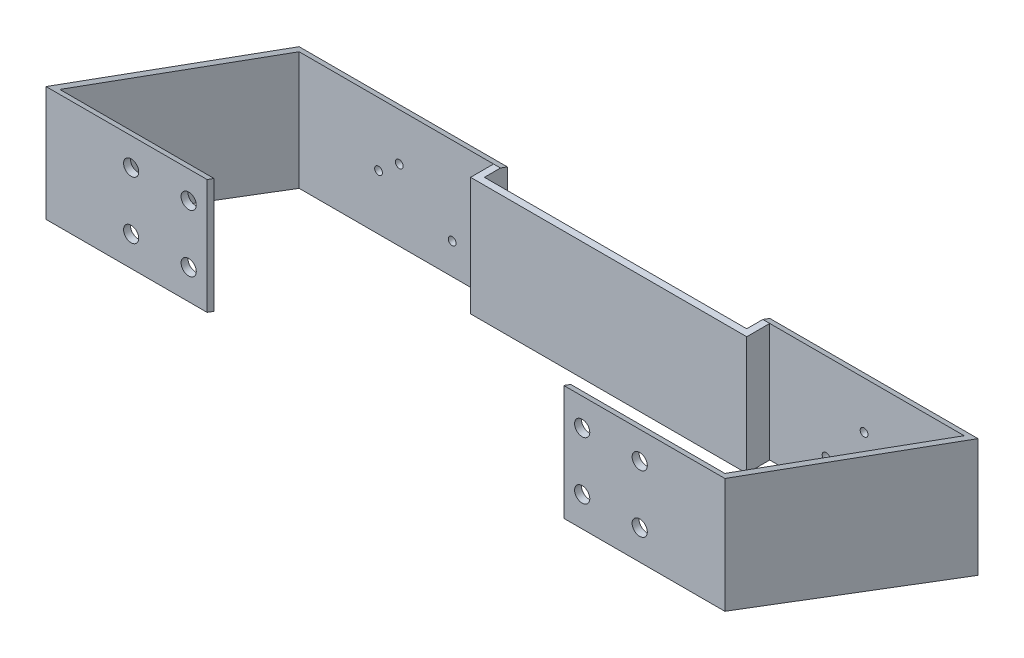
from build123d import *

# Parameters (mm, degrees)
SKETCH_1_W             = 295
SKETCH_1_H             = 91.45
EXTRUDE_1_DEPTH        = 3
SKETCH_4_W             = 3
SKETCH_4_H             = 91.45
EXTRUDE_2_DEPTH        = 104
SKETCH_5_W             = 70
SKETCH_5_H             = 91.45
EXTRUDE_3_DEPTH        = 3
CUT_EXTRUDE_1_DEPTH    = 322.574228766
HOLE_WIZARD_M6_1_D     = 6.6
HOLE_WIZARD_M6_1_DEPTH = 3
HOLE_WIZARD_M3_1_D     = 3.4
SKETCH_39_W            = 3
SKETCH_39_H            = 51.410454545
EXTRUDE_5_DEPTH        = 10
SKETCH_42_W            = 3
SKETCH_42_H            = 51.410454545
EXTRUDE_6_DEPTH        = 117
CUT_EXTRUDE_5_REACH    = 219.563
SKETCH_44_W            = 114
SKETCH_44_H            = 52.54090909


with BuildPart() as part:
    # ｽｹｯﾁ1 → ﾎﾞｽ - 押し出し1 (new body)
    with BuildSketch(Plane.XY):
        with Locations((28.42242268, -19.734793814)):
            Rectangle(SKETCH_1_W, SKETCH_1_H)
    extrude(amount=EXTRUDE_1_DEPTH)

    # ｽｹｯﾁ4 → ﾎﾞｽ - 押し出し2 (add)
    with BuildSketch(Plane.XY.offset(3)):
        with Locations((-117.57757732, -19.734793814)):
            Rectangle(SKETCH_4_W, SKETCH_4_H)
        with Locations((174.42242268, -19.734793814)):
            Rectangle(SKETCH_4_W, SKETCH_4_H)
    extrude(amount=EXTRUDE_2_DEPTH)

    # ｽｹｯﾁ5 → ﾎﾞｽ - 押し出し3 (add)
    with BuildSketch(Plane.XY.offset(107)):
        with Locations((-84.07757732, -19.734793814)):
            Rectangle(SKETCH_5_W, SKETCH_5_H)
        with Locations((140.92242268, -19.734793814)):
            Rectangle(SKETCH_5_W, SKETCH_5_H)
    extrude(amount=EXTRUDE_3_DEPTH)

    # ｽｹｯﾁ24 → ｶｯﾄ - 押し出し1 (cut, through all)
    with BuildSketch(Plane(origin=(175.92242268, 0, 0), x_dir=(0, 0, -1), z_dir=(1, 0, 0))):
        Polygon((-110, 25.990206186), (0, -14.009793814), (0, 25.990206186), align=None)
        Polygon((-110, -65.459793814), (0, -65.459793814), (-110, -24.009793814), align=None)
    extrude(amount=-CUT_EXTRUDE_1_DEPTH, mode=Mode.SUBTRACT)

    # M6 すきま穴1
    with Locations(Plane.XY.offset(110)):
        with Locations((113.92242268, 13.990206186), (113.92242268, -11.009793814), (138.92242268, -11.009793814), (138.92242268, 13.990206186), (-57.07757732, 13.990206186), (-57.07757732, -11.009793814), (-82.07757732, -11.009793814), (-82.07757732, 13.990206186)):
            Hole(HOLE_WIZARD_M6_1_D / 2, depth=HOLE_WIZARD_M6_1_DEPTH)

    # M3 すきま穴1 (through all)
    with Locations(Plane.XY.offset(3)):
        with Locations((-72.57757732, -33.418884724), (-81.57757732, -40.418884724), (-49.57757732, -50.918884724), (138.42242268, -40.418884724), (129.42242268, -33.418884724), (112.92242268, -50.918884724)):
            Hole(HOLE_WIZARD_M3_1_D / 2)

    # ｽｹｯﾁ39 → ﾎﾞｽ - 押し出し5 (add)
    with BuildSketch(Plane.XY.offset(3)):
        with Locations((-30.07757732, -38.624111997)):
            Rectangle(SKETCH_39_W, SKETCH_39_H)
        with Locations((86.92242268, -38.624111997)):
            Rectangle(SKETCH_39_W, SKETCH_39_H)
    extrude(amount=EXTRUDE_5_DEPTH)

    # ｽｹｯﾁ42 → ﾎﾞｽ - 押し出し6 (add)
    with BuildSketch(Plane(origin=(88.42242268, 0, 0), x_dir=(0, 0, -1), z_dir=(1, 0, 0))):
        with Locations((-11.5, -38.624111997)):
            Rectangle(SKETCH_42_W, SKETCH_42_H)
    extrude(amount=-EXTRUDE_6_DEPTH)

    # ｽｹｯﾁ44 → ｶｯﾄ - 押し出し5 (cut, up to next)
    with BuildSketch(Plane(origin=(0, 0, 0), x_dir=(-1, 0, 0), z_dir=(0, 0, -1)), mode=Mode.PRIVATE) as cut_extrude_5_sk1:
        with Locations((-28.42242268, -39.189339269)):
            Rectangle(SKETCH_44_W, SKETCH_44_H)
    cut_extrude_5_tool1 = extrude(cut_extrude_5_sk1.sketch, amount=-CUT_EXTRUDE_5_REACH, mode=Mode.PRIVATE) & part.part
    add(cut_extrude_5_tool1.solids().sort_by_distance((28.422423, -39.189339, 0))[0], mode=Mode.SUBTRACT)


solid = part.part
